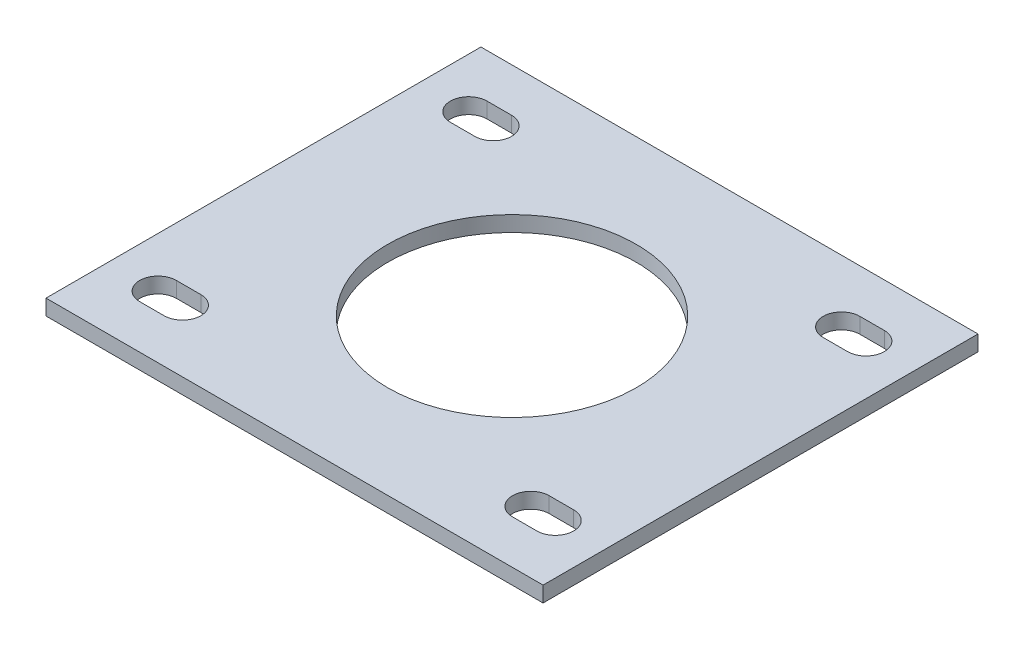
from build123d import *

# Parameters (mm, degrees)
SKETCH1_W           = 101.6
SKETCH1_H           = 88.9
SKETCH1_R           = 25.4
BOSS_EXTRUDE1_DEPTH = 3.175
CUT_EXTRUDE1_DEPTH  = 68.576054376


with BuildPart() as part:
    # Sketch1 → Boss-Extrude1 (new body)
    with BuildSketch(Plane(origin=(0, 0, 0), x_dir=(1, 0, 0), z_dir=(0, 1, 0))):
        Rectangle(SKETCH1_W, SKETCH1_H)
        with Locations(Location((0, 0, 0), (0, 0, 270))):
            Circle(SKETCH1_R, mode=Mode.SUBTRACT)
    extrude(amount=BOSS_EXTRUDE1_DEPTH)

    # Sketch2 → Cut-Extrude1 (cut, through all)
    with BuildSketch(Plane(origin=(0, 3.175, 0), x_dir=(1, 0, 0), z_dir=(0, 1, 0))):
        with BuildLine():
            Line((-40.6, 35.5), (-35.6, 35.5))
            ThreePointArc((-35.6, 35.5), (-31.85, 31.75), (-35.6, 28))
            Line((-35.6, 28), (-40.6, 28))
            ThreePointArc((-40.6, 28), (-44.35, 31.75), (-40.6, 35.5))
        make_face()
        with BuildLine():
            Line((-40.6, -28), (-35.6, -28))
            ThreePointArc((-35.6, -28), (-31.85, -31.75), (-35.6, -35.5))
            Line((-35.6, -35.5), (-40.6, -35.5))
            ThreePointArc((-40.6, -35.5), (-44.35, -31.75), (-40.6, -28))
        make_face()
        with BuildLine():
            Line((35.6, 35.5), (40.6, 35.5))
            ThreePointArc((40.6, 35.5), (44.35, 31.75), (40.6, 28))
            Line((40.6, 28), (35.6, 28))
            ThreePointArc((35.6, 28), (31.85, 31.75), (35.6, 35.5))
        make_face()
        with BuildLine():
            Line((35.6, -28), (40.6, -28))
            ThreePointArc((40.6, -28), (44.35, -31.75), (40.6, -35.5))
            Line((40.6, -35.5), (35.6, -35.5))
            ThreePointArc((35.6, -35.5), (31.85, -31.75), (35.6, -28))
        make_face()
    extrude(amount=-CUT_EXTRUDE1_DEPTH, mode=Mode.SUBTRACT)


solid = part.part
